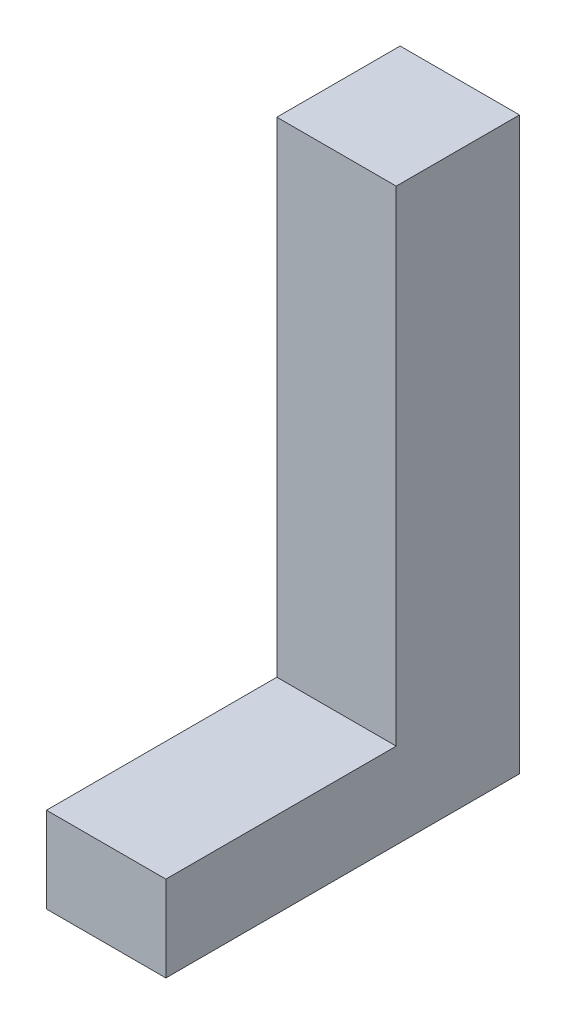
from build123d import *

# Parameters (mm, degrees)
SKETCH1_W           = 145
SKETCH1_H           = 104
BOSS_EXTRUDE1_DEPTH = 429.514512898
SKETCH2_W           = 145
SKETCH2_H           = 149.737576067
BOSS_EXTRUDE2_DEPTH = 589.026512898


with BuildPart() as part:
    # Sketch1 → Boss-Extrude1 (new body)
    with BuildSketch(Plane(origin=(0, 0, -55.73), x_dir=(-1, 0, 0), z_dir=(0, 0, -1))):
        with Locations((232.5, 52)):
            Rectangle(SKETCH1_W, SKETCH1_H)
    extrude(amount=BOSS_EXTRUDE1_DEPTH)

    # Sketch2 → Boss-Extrude2 (add)
    with BuildSketch(Plane(origin=(0, 104, 0), x_dir=(1, 0, 0), z_dir=(0, 1, 0))):
        with Locations((-232.5, 410.375724865)):
            Rectangle(SKETCH2_W, SKETCH2_H)
    extrude(amount=BOSS_EXTRUDE2_DEPTH)


solid = part.part
